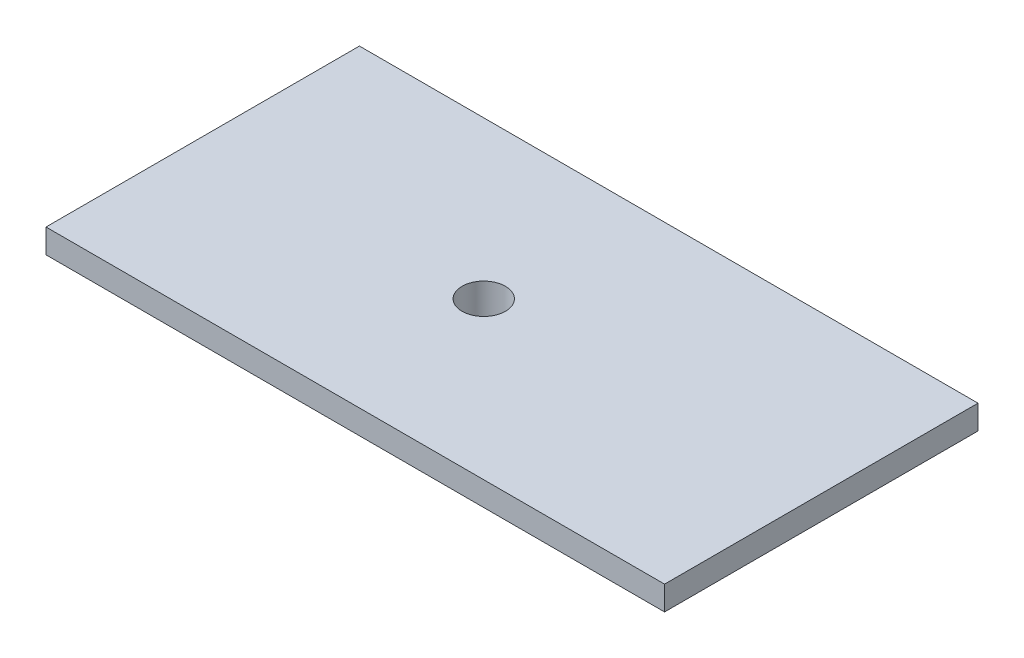
from build123d import *

# Parameters (mm, degrees)
SKETCH1_W           = 128.28
SKETCH1_H           = 65
BOSS_EXTRUDE1_DEPTH = 5
SKETCH3_W           = 118.08
SKETCH3_H           = 54.8
BOSS_EXTRUDE2_DEPTH = 5
CUT_EXTRUDE1_REACH  = 146.155
SKETCH4_R           = 4.5


with BuildPart() as part:
    # Sketch1 → Boss-Extrude1 (new body)
    with BuildSketch(Plane(origin=(0, 0, 0), x_dir=(1, 0, 0), z_dir=(0, 1, 0))):
        with Locations((-64.14, 32.5)):
            Rectangle(SKETCH1_W, SKETCH1_H)
    extrude(amount=BOSS_EXTRUDE1_DEPTH)

    # Sketch3 → Boss-Extrude2 (add)
    with BuildSketch(Plane.XZ):
        with Locations((-64.14, -32.5)):
            Rectangle(SKETCH3_W, SKETCH3_H)
    extrude(amount=BOSS_EXTRUDE2_DEPTH)

    # Sketch4 → Cut-Extrude1 (cut, up to next)
    with BuildSketch(Plane(origin=(0, 5, 0), x_dir=(1, 0, 0), z_dir=(0, 1, 0)), mode=Mode.PRIVATE) as cut_extrude1_sk1:
        with Locations(Location((-70, 32.5, 0), (0, 0, 270))):
            Circle(SKETCH4_R)
    cut_extrude1_tool1 = extrude(cut_extrude1_sk1.sketch, amount=-CUT_EXTRUDE1_REACH, mode=Mode.PRIVATE) & part.part
    add(cut_extrude1_tool1.solids().sort_by_distance((-70, 5, -32.5))[0], mode=Mode.SUBTRACT)


solid = part.part
